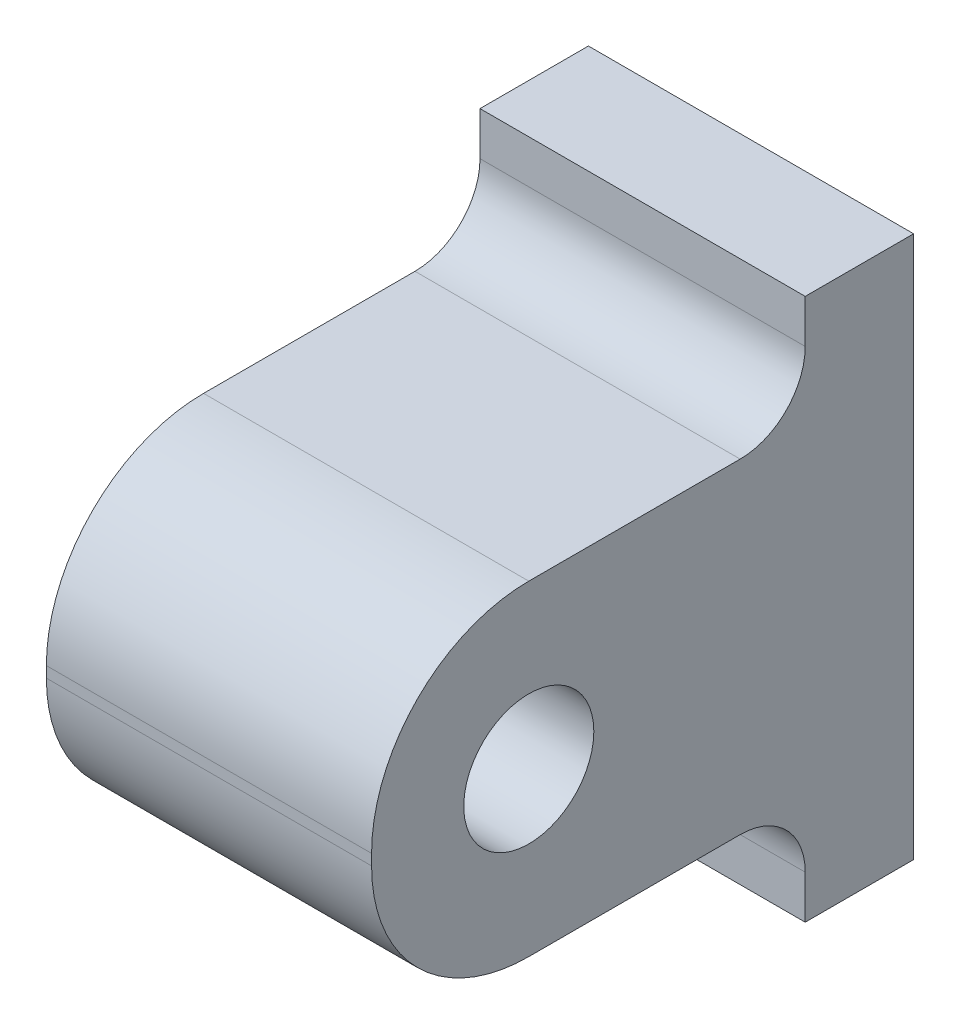
from build123d import *

# Parameters (mm, degrees)
RESSALTO_EXTRUS_O1_DEPTH = 30
ESBO_O2_R                = 6
CORTE_EXTRUS_O1_DEPTH    = 30


with BuildPart() as part:
    # Esboço1 → Ressalto-extrusão1 (new body)
    with BuildSketch(Plane(origin=(0, 0, 0), x_dir=(0, 0, -1), z_dir=(1, 0, 0))):
        with BuildLine():
            Line((29.081161235, 22.413898957), (29.081161235, -27.586101043))
            Line((29.081161235, -27.586101043), (19.081161235, -27.586101043))
            Line((19.081161235, -27.586101043), (19.081161235, -23.586101043))
            ThreePointArc((19.081161235, -23.586101043), (17.323801922, -19.343460356), (13.081161235, -17.586101043))
            Line((13.081161235, -17.586101043), (-6.418838765, -17.586101043))
            ThreePointArc((-6.418838765, -17.586101043), (-16.671887093, -13.33914937), (-20.918838765, -3.086101043))
            Line((-20.918838765, -3.086101043), (-20.918838765, -2.086101043))
            ThreePointArc((-20.918838765, -2.086101043), (-16.671887093, 8.166947284), (-6.418838765, 12.413898957))
            Line((-6.418838765, 12.413898957), (13.081161235, 12.413898957))
            ThreePointArc((13.081161235, 12.413898957), (17.323801922, 14.17125827), (19.081161235, 18.413898957))
            Line((19.081161235, 18.413898957), (19.081161235, 22.413898957))
            Line((19.081161235, 22.413898957), (29.081161235, 22.413898957))
        make_face()
    extrude(amount=RESSALTO_EXTRUS_O1_DEPTH)

    # Esboço2 → Corte-extrusão1 (cut)
    with BuildSketch(Plane(origin=(0, 0, 0), x_dir=(0, 0, -1), z_dir=(1, 0, 0))):
        with Locations((-6.418838765, -2.586101043)):
            Circle(ESBO_O2_R)
    extrude(amount=CORTE_EXTRUS_O1_DEPTH, mode=Mode.SUBTRACT)


solid = part.part
